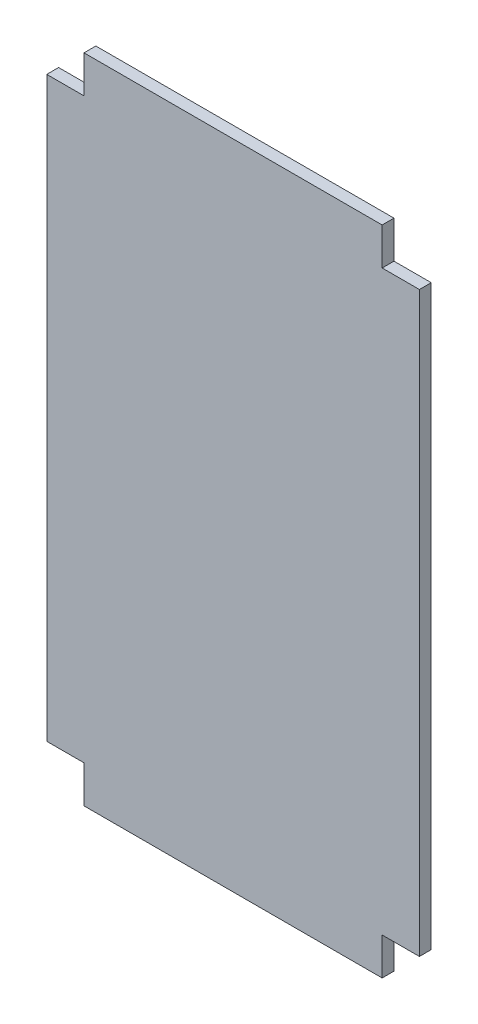
from build123d import *

# Parameters (mm, degrees)
BOSS_EXTRUDE1_DEPTH = 6.35


with BuildPart() as part:
    # Sketch1 → Boss-Extrude1 (new body)
    with BuildSketch(Plane.XY):
        Polygon((-155, -195), (5, -195), (5, -175), (25, -175), (25, 135), (5, 135), (5, 155), (-155, 155), (-155, 135), (-175, 135), (-175, -175), (-155, -175), align=None)
    extrude(amount=BOSS_EXTRUDE1_DEPTH)


solid = part.part
